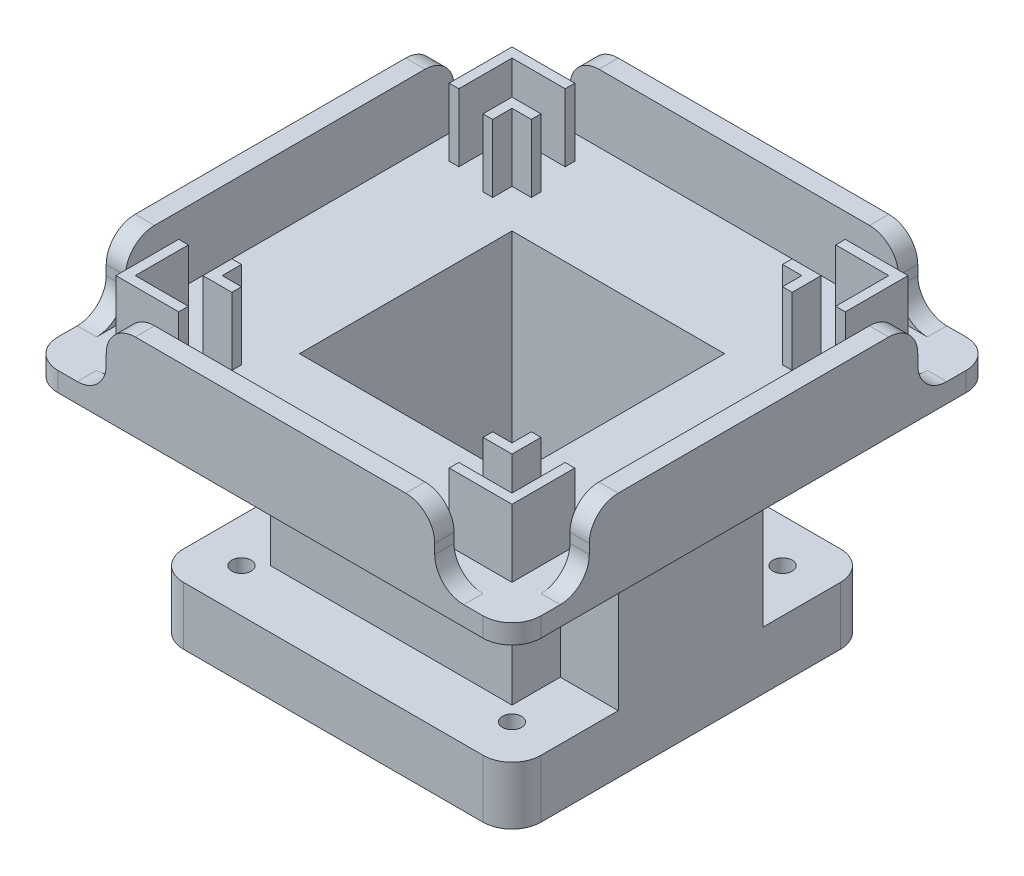
from build123d import *

# Parameters (mm, degrees)
SKETCH_2_W            = 37
SKETCH_2_H            = 37
EXTRUDE_1_DEPTH       = 23
SKETCH_3_W            = 22
SKETCH_3_H            = 22
CUT_EXTRUDE_1_DEPTH   = 23
SKETCH_19_OUTSIDE_W   = 50.432
SKETCH_19_OUTSIDE_H   = 50.432
SKETCH_19_OUTSIDE_W_2 = 25
SKETCH_19_OUTSIDE_H_2 = 25
CUT_EXTRUDE_17_DEPTH  = 17
SKETCH_4_W            = 50
SKETCH_4_H            = 50
EXTRUDE_2_DEPTH       = 9
SKETCH_5_W            = 46
SKETCH_5_H            = 46
CUT_EXTRUDE_3_DEPTH   = 7
SKETCH_12_W           = 8
SKETCH_12_H           = 8
CUT_EXTRUDE_14_DEPTH  = 14
SKETCH_6_W            = 22
SKETCH_6_H            = 22
CUT_EXTRUDE_4_DEPTH   = 2
SKETCH_11_R           = 1
CUT_EXTRUDE_7_DEPTH   = 8
SKETCH_13_W           = 41
SKETCH_13_H           = 41
SKETCH_13_W_2         = 39
SKETCH_13_H_2         = 39
EXTRUDE_3_DEPTH       = 7
SKETCH_17_W           = 32
SKETCH_17_H           = 32
SKETCH_17_W_2         = 30
SKETCH_17_H_2         = 30
EXTRUDE_4_DEPTH       = 7
SKETCH_15_W           = 28
SKETCH_15_H           = 1
SKETCH_15_W_2         = 1
SKETCH_15_H_2         = 28
CUT_EXTRUDE_15_DEPTH  = 7
SKETCH_18_W           = 1
SKETCH_18_H           = 26
SKETCH_18_W_2         = 26
SKETCH_18_H_2         = 1
CUT_EXTRUDE_16_DEPTH  = 7
SKETCH_20_W           = 3
SKETCH_20_H           = 10.5
CUT_EXTRUDE_18_DEPTH  = 3.5
SKETCH_21_W           = 4.5
SKETCH_21_H           = 10
CUT_EXTRUDE_19_DEPTH  = 1
SKETCH_22_W           = 5
SKETCH_22_H           = 1
CUT_EXTRUDE_21_DEPTH  = 7
SKETCH_24_W           = 6
SKETCH_24_H           = 4.5
CUT_EXTRUDE_22_DEPTH  = 1
SKETCH_25_W           = 6
SKETCH_25_H           = 15
EXTRUDE_5_DEPTH       = 17
FILLET_5_R            = 3
FILLET_6_R            = 3
FILLET_10_R           = 3
FILLET_11_R           = 3
FILLET_12_R           = 3
FILLET_14_R           = 3
FILLET_15_R           = 3
FILLET_16_R           = 3
FILLET_19_R           = 3
FILLET_20_R           = 3
FILLET_21_R           = 3
FILLET_22_R           = 3
FILLET_28_R           = 3
FILLET_29_R           = 3
FILLET_30_R           = 3
FILLET_31_R           = 3
FILLET_32_R           = 3
FILLET_33_R           = 3
FILLET_34_R           = 3
FILLET_35_R           = 3
FILLET_36_R           = 3
FILLET_37_R           = 3
FILLET_38_R           = 3
FILLET_39_R           = 3


with BuildPart() as part:
    # 草图2 → 凸台-拉伸1 (new body)
    with BuildSketch(Plane(origin=(0, 0, 0), x_dir=(1, 0, 0), z_dir=(0, 1, 0))):
        Rectangle(SKETCH_2_W, SKETCH_2_H)
    extrude(amount=EXTRUDE_1_DEPTH)

    # 草图3 → 切除-拉伸1 (cut)
    with BuildSketch(Plane.XZ):
        Rectangle(SKETCH_3_W, SKETCH_3_H)
    extrude(amount=-CUT_EXTRUDE_1_DEPTH, mode=Mode.SUBTRACT)

    # 草图19 outside → 切除-拉伸17 (cut)
    with BuildSketch(Plane(origin=(0, 6, 0), x_dir=(-1, 0, 0), z_dir=(0, -1, 0))):
        Rectangle(SKETCH_19_OUTSIDE_W, SKETCH_19_OUTSIDE_H)
        Rectangle(SKETCH_19_OUTSIDE_W_2, SKETCH_19_OUTSIDE_H_2, mode=Mode.SUBTRACT)
    extrude(amount=-CUT_EXTRUDE_17_DEPTH, mode=Mode.SUBTRACT)

    # 草图4 → 凸台-拉伸2 (add)
    with BuildSketch(Plane(origin=(0, 23, 0), x_dir=(1, 0, 0), z_dir=(0, 1, 0))):
        Rectangle(SKETCH_4_W, SKETCH_4_H)
    extrude(amount=EXTRUDE_2_DEPTH)

    # 草图5 → 切除-拉伸3 (cut)
    with BuildSketch(Plane(origin=(0, 32, 0), x_dir=(1, 0, 0), z_dir=(0, 1, 0))):
        Rectangle(SKETCH_5_W, SKETCH_5_H)
    extrude(amount=-CUT_EXTRUDE_3_DEPTH, mode=Mode.SUBTRACT)

    # 草图12 → 切除-拉伸14 (cut)
    with BuildSketch(Plane(origin=(0, 25, 0), x_dir=(1, 0, 0), z_dir=(0, 1, 0))):
        with Locations((-21, -21)):
            Rectangle(SKETCH_12_W, SKETCH_12_H)
        with Locations((-21, 21)):
            Rectangle(SKETCH_12_W, SKETCH_12_H)
        with Locations((21, 21)):
            Rectangle(SKETCH_12_W, SKETCH_12_H)
        with Locations((21, -21)):
            Rectangle(SKETCH_12_W, SKETCH_12_H)
    extrude(amount=CUT_EXTRUDE_14_DEPTH, mode=Mode.SUBTRACT)

    # 草图6 → 切除-拉伸4 (cut)
    with BuildSketch(Plane(origin=(0, 25, 0), x_dir=(1, 0, 0), z_dir=(0, 1, 0))):
        Rectangle(SKETCH_6_W, SKETCH_6_H)
    extrude(amount=-CUT_EXTRUDE_4_DEPTH, mode=Mode.SUBTRACT)

    # 草图11 → 切除-拉伸7 (cut)
    with BuildSketch(Plane.XZ):
        with Locations(Location((14, 14, 0), (0, 0, 270))):
            Circle(SKETCH_11_R)
        with Locations(Location((14, -14, 0), (0, 0, 270))):
            Circle(SKETCH_11_R)
        with Locations(Location((-14, -14, 0), (0, 0, 270))):
            Circle(SKETCH_11_R)
        with Locations(Location((-14, 14, 0), (0, 0, 270))):
            Circle(SKETCH_11_R)
    extrude(amount=-CUT_EXTRUDE_7_DEPTH, mode=Mode.SUBTRACT)

    # 草图13 → 凸台-拉伸3 (add)
    with BuildSketch(Plane(origin=(0, 25, 0), x_dir=(1, 0, 0), z_dir=(0, 1, 0))):
        Rectangle(SKETCH_13_W, SKETCH_13_H)
        Rectangle(SKETCH_13_W_2, SKETCH_13_H_2, mode=Mode.SUBTRACT)
    extrude(amount=EXTRUDE_3_DEPTH)

    # 草图17 → 凸台-拉伸4 (add)
    with BuildSketch(Plane(origin=(0, 25, 0), x_dir=(1, 0, 0), z_dir=(0, 1, 0))):
        Rectangle(SKETCH_17_W, SKETCH_17_H)
        Rectangle(SKETCH_17_W_2, SKETCH_17_H_2, mode=Mode.SUBTRACT)
    extrude(amount=EXTRUDE_4_DEPTH)

    # 草图15 → 切除-拉伸15 (cut)
    with BuildSketch(Plane(origin=(0, 25, 0), x_dir=(1, 0, 0), z_dir=(0, 1, 0))):
        with Locations((0, -20)):
            Rectangle(SKETCH_15_W, SKETCH_15_H)
        with Locations((20, 0)):
            Rectangle(SKETCH_15_W_2, SKETCH_15_H_2)
        with Locations((-20, 0)):
            Rectangle(SKETCH_15_W_2, SKETCH_15_H_2)
        with Locations((0, 20)):
            Rectangle(SKETCH_15_W, SKETCH_15_H)
    extrude(amount=CUT_EXTRUDE_15_DEPTH, mode=Mode.SUBTRACT)

    # 草图18 → 切除-拉伸16 (cut)
    with BuildSketch(Plane(origin=(0, 25, 0), x_dir=(1, 0, 0), z_dir=(0, 1, 0))):
        with Locations((15.5, 0)):
            Rectangle(SKETCH_18_W, SKETCH_18_H)
        with Locations((0, -15.5)):
            Rectangle(SKETCH_18_W_2, SKETCH_18_H_2)
        with Locations((-15.5, 0)):
            Rectangle(SKETCH_18_W, SKETCH_18_H)
        with Locations((0, 15.5)):
            Rectangle(SKETCH_18_W_2, SKETCH_18_H_2)
    extrude(amount=CUT_EXTRUDE_16_DEPTH, mode=Mode.SUBTRACT)

    # 草图20 → 切除-拉伸18 (cut)
    with BuildSketch(Plane.XZ):
        with Locations((12.5, -5.25)):
            Rectangle(SKETCH_20_W, SKETCH_20_H)
    extrude(amount=-CUT_EXTRUDE_18_DEPTH, mode=Mode.SUBTRACT)

    # 草图21 → 切除-拉伸19 (cut)
    with BuildSketch(Plane.XZ):
        with Locations((-13.25, -2)):
            Rectangle(SKETCH_21_W, SKETCH_21_H)
    extrude(amount=-CUT_EXTRUDE_19_DEPTH, mode=Mode.SUBTRACT)

    # 草图22 → 切除-拉伸21 (cut)
    with BuildSketch(Plane.XZ):
        with Locations((0, -11.5)):
            Rectangle(SKETCH_22_W, SKETCH_22_H)
        with Locations((0, 11.5)):
            Rectangle(SKETCH_22_W, SKETCH_22_H)
    extrude(amount=-CUT_EXTRUDE_21_DEPTH, mode=Mode.SUBTRACT)

    # 草图24 → 切除-拉伸22 (cut)
    with BuildSketch(Plane.XZ):
        with Locations((-4.5, -13.25)):
            Rectangle(SKETCH_24_W, SKETCH_24_H)
    extrude(amount=-CUT_EXTRUDE_22_DEPTH, mode=Mode.SUBTRACT)

    # 草图25 → 凸台-拉伸5 (add)
    with BuildSketch(Plane(origin=(0, 6, 0), x_dir=(1, 0, 0), z_dir=(0, 1, 0))):
        with Locations((15.5, 0)):
            Rectangle(SKETCH_25_W, SKETCH_25_H)
    extrude(amount=EXTRUDE_5_DEPTH)

    # 圆角5
    fillet_5_edges = [part.edges().sort_by_distance(p)[0] for p in [
        (25, 24, -25),
    ]]
    fillet(fillet_5_edges, radius=FILLET_5_R)

    # 圆角6
    fillet_6_edges = [part.edges().sort_by_distance(p)[0] for p in [
        (25, 24, 25),
    ]]
    fillet(fillet_6_edges, radius=FILLET_6_R)

    # 圆角10
    fillet_10_edges = [part.edges().sort_by_distance(p)[0] for p in [
        (17, 25, -24),
    ]]
    fillet(fillet_10_edges, radius=FILLET_10_R)

    # 圆角11
    fillet_11_edges = [part.edges().sort_by_distance(p)[0] for p in [
        (24, 32, -17),
    ]]
    fillet(fillet_11_edges, radius=FILLET_11_R)

    # 圆角12
    fillet_12_edges = [part.edges().sort_by_distance(p)[0] for p in [
        (24, 25, -17),
    ]]
    fillet(fillet_12_edges, radius=FILLET_12_R)

    # 圆角14
    fillet_14_edges = [part.edges().sort_by_distance(p)[0] for p in [
        (17, 25, 24),
    ]]
    fillet(fillet_14_edges, radius=FILLET_14_R)

    # 圆角15
    fillet_15_edges = [part.edges().sort_by_distance(p)[0] for p in [
        (24, 32, 17),
    ]]
    fillet(fillet_15_edges, radius=FILLET_15_R)

    # 圆角16
    fillet_16_edges = [part.edges().sort_by_distance(p)[0] for p in [
        (24, 25, 17),
    ]]
    fillet(fillet_16_edges, radius=FILLET_16_R)

    # 圆角19
    fillet_19_edges = [part.edges().sort_by_distance(p)[0] for p in [
        (-18.5, 3, -18.5),
    ]]
    fillet(fillet_19_edges, radius=FILLET_19_R)

    # 圆角20
    fillet_20_edges = [part.edges().sort_by_distance(p)[0] for p in [
        (-18.5, 3, 18.5),
    ]]
    fillet(fillet_20_edges, radius=FILLET_20_R)

    # 圆角21
    fillet_21_edges = [part.edges().sort_by_distance(p)[0] for p in [
        (18.5, 3, 18.5),
    ]]
    fillet(fillet_21_edges, radius=FILLET_21_R)

    # 圆角22
    fillet_22_edges = [part.edges().sort_by_distance(p)[0] for p in [
        (18.5, 3, -18.5),
    ]]
    fillet(fillet_22_edges, radius=FILLET_22_R)

    # 圆角28
    fillet_28_edges = [part.edges().sort_by_distance(p)[0] for p in [
        (-17, 25, -24),
    ]]
    fillet(fillet_28_edges, radius=FILLET_28_R)

    # 圆角29
    fillet_29_edges = [part.edges().sort_by_distance(p)[0] for p in [
        (-24, 25, -17),
    ]]
    fillet(fillet_29_edges, radius=FILLET_29_R)

    # 圆角30
    fillet_30_edges = [part.edges().sort_by_distance(p)[0] for p in [
        (-24, 25, 17),
    ]]
    fillet(fillet_30_edges, radius=FILLET_30_R)

    # 圆角31
    fillet_31_edges = [part.edges().sort_by_distance(p)[0] for p in [
        (-17, 25, 24),
    ]]
    fillet(fillet_31_edges, radius=FILLET_31_R)

    # 圆角32
    fillet_32_edges = [part.edges().sort_by_distance(p)[0] for p in [
        (17, 32, 24),
    ]]
    fillet(fillet_32_edges, radius=FILLET_32_R)

    # 圆角33
    fillet_33_edges = [part.edges().sort_by_distance(p)[0] for p in [
        (-17, 32, 24),
    ]]
    fillet(fillet_33_edges, radius=FILLET_33_R)

    # 圆角34
    fillet_34_edges = [part.edges().sort_by_distance(p)[0] for p in [
        (17, 32, -24),
    ]]
    fillet(fillet_34_edges, radius=FILLET_34_R)

    # 圆角35
    fillet_35_edges = [part.edges().sort_by_distance(p)[0] for p in [
        (-17, 32, -24),
    ]]
    fillet(fillet_35_edges, radius=FILLET_35_R)

    # 圆角36
    fillet_36_edges = [part.edges().sort_by_distance(p)[0] for p in [
        (-24, 32, 17),
    ]]
    fillet(fillet_36_edges, radius=FILLET_36_R)

    # 圆角37
    fillet_37_edges = [part.edges().sort_by_distance(p)[0] for p in [
        (-24, 32, -17),
    ]]
    fillet(fillet_37_edges, radius=FILLET_37_R)

    # 圆角38
    fillet_38_edges = [part.edges().sort_by_distance(p)[0] for p in [
        (-25, 24, 25),
    ]]
    fillet(fillet_38_edges, radius=FILLET_38_R)

    # 圆角39
    fillet_39_edges = [part.edges().sort_by_distance(p)[0] for p in [
        (-25, 24, -25),
    ]]
    fillet(fillet_39_edges, radius=FILLET_39_R)


solid = part.part
